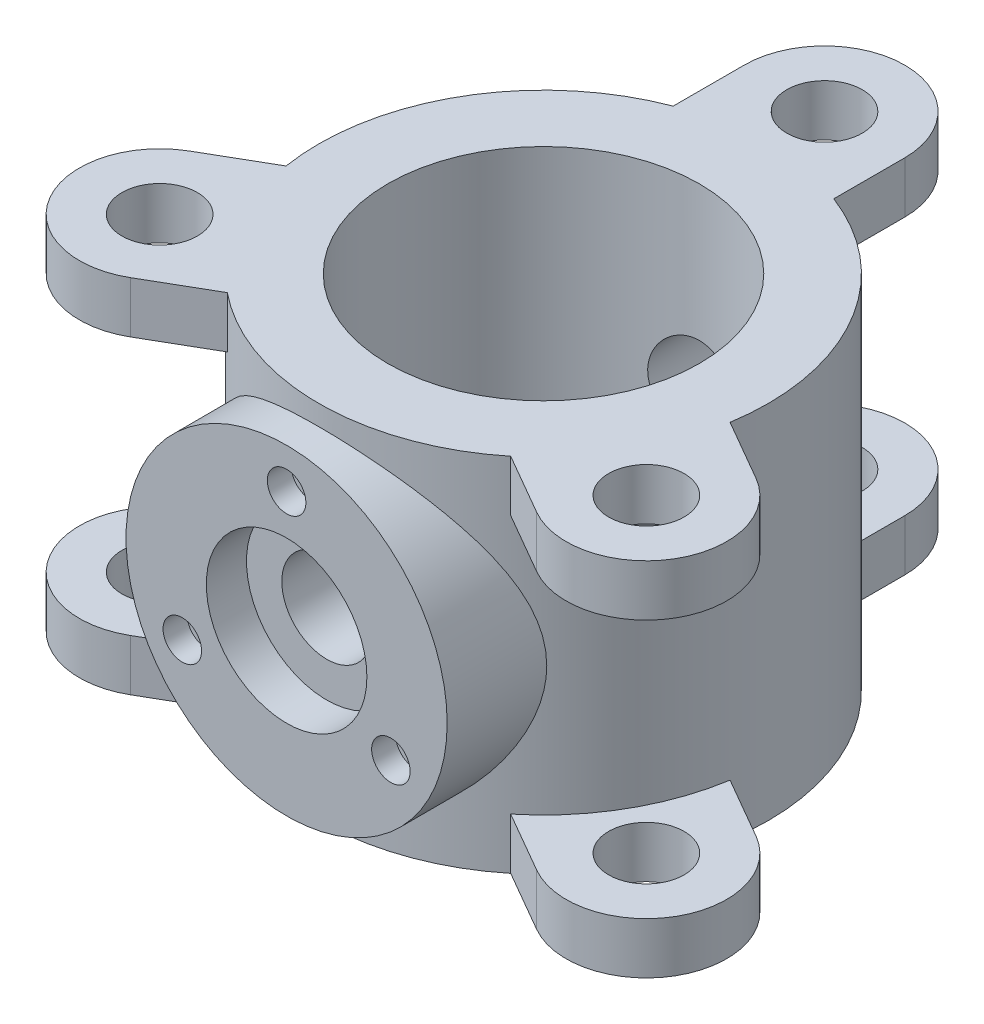
from build123d import *

# Parameters (mm, degrees)
SKETCH1_R                = 140
SKETCH1_R_2              = 97
BOSS_EXTRUDE1_DEPTH      = 225
SKETCH3_R                = 23.5
BOSS_EXTRUDE2_DEPTH      = 32
CIRPATTERN1_COUNT        = 3
MIRROR1_COPY_1_SKETCH_R  = 23.5
MIRROR1_COPY_1_DEPTH     = 32
MIRROR1_COPY_2_SKETCH_R  = 23.5
MIRROR1_COPY_2_DEPTH     = 32
BOSS_EXTRUDE3_REACH      = 491.361
BOSS_EXTRUDE3_END_RADIUS = 140
SKETCH4_R                = 100
SKETCH5_R                = 50
CUT_EXTRUDE1_DEPTH       = 25
SKETCH6_R                = 28
CUT_EXTRUDE2_DEPTH       = 470.945948606
SKETCH7_R                = 12
CUT_EXTRUDE3_DEPTH       = 15
CIRPATTERN2_COUNT        = 3


with BuildPart() as part:
    # Sketch1 → Boss-Extrude1 (new body)
    with BuildSketch(Plane(origin=(0, 0, 0), x_dir=(1, 0, 0), z_dir=(0, 1, 0))):
        with Locations(Location((0, 0, 0), (0, 0, 270))):
            Circle(SKETCH1_R)
        with Locations(Location((0, 0, 0), (0, 0, 270))):
            Circle(SKETCH1_R_2, mode=Mode.SUBTRACT)
    extrude(amount=BOSS_EXTRUDE1_DEPTH)

    # Sketch3 → Boss-Extrude2 (add)
    with BuildSketch(Plane(origin=(0, 225, 0), x_dir=(1, 0, 0), z_dir=(0, 1, 0))):
        with BuildLine():
            Line((50, 175), (50, 101.987166255))
            Line((50, 101.987166255), (-50, 101.987166255))
            Line((-50, 101.987166255), (-50, 175))
            ThreePointArc((-50, 175), (0, 225), (50, 175))
        make_face()
        with Locations(Location((0, 175, 0), (0, 0, 270))):
            Circle(SKETCH3_R, mode=Mode.SUBTRACT)
    boss_extrude2 = extrude(amount=-BOSS_EXTRUDE2_DEPTH)

    # CirPattern1: Boss-Extrude2 ×3 about axis
    cirpattern1_axis = Axis((0, 0, 0), (0, 1, 0))
    for i in range(1, CIRPATTERN1_COUNT):
        add(boss_extrude2.rotate(cirpattern1_axis, i * 360 / CIRPATTERN1_COUNT))

    # Mirror1: Boss-Extrude2 across plane
    add(boss_extrude2.mirror(Plane.ZX.offset(112.5)))

    # Mirror1 copy 1 sketch → Mirror1 copy 1 (add)
    with BuildSketch(Plane(origin=(0, 0, 0), x_dir=(-0.4999999999999998, 0, -0.8660254037844387), z_dir=(0, -1, 0))):
        with BuildLine():
            Line((50, -175), (50, -101.987166255))
            Line((50, -101.987166255), (-50, -101.987166255))
            Line((-50, -101.987166255), (-50, -175))
            ThreePointArc((-50, -175), (0, -225), (50, -175))
        make_face()
        with Locations((0, -175)):
            Circle(MIRROR1_COPY_1_SKETCH_R, mode=Mode.SUBTRACT)
    extrude(amount=-MIRROR1_COPY_1_DEPTH)

    # Mirror1 copy 2 sketch → Mirror1 copy 2 (add)
    with BuildSketch(Plane(origin=(0, 0, 0), x_dir=(-0.5000000000000004, 0, 0.8660254037844384), z_dir=(0, -1, 0))):
        with BuildLine():
            Line((50, -175), (50, -101.987166255))
            Line((50, -101.987166255), (-50, -101.987166255))
            Line((-50, -101.987166255), (-50, -175))
            ThreePointArc((-50, -175), (0, -225), (50, -175))
        make_face()
        with Locations((0, -175)):
            Circle(MIRROR1_COPY_2_SKETCH_R, mode=Mode.SUBTRACT)
    extrude(amount=-MIRROR1_COPY_2_DEPTH)

    # Boss-Extrude3: up to this cylinder (the profile starts outside it)
    boss_extrude3_end = Plane(origin=(0, 112.5, 0), z_dir=(0, -1, 0)) * Cylinder(BOSS_EXTRUDE3_END_RADIUS, 1263.722, mode=Mode.PRIVATE)
    # Sketch4 → Boss-Extrude3 (add, up to the surface)
    with BuildSketch(Plane.XY.offset(160), mode=Mode.PRIVATE) as boss_extrude3_sk1:
        with Locations((0, 112.5)):
            Circle(SKETCH4_R)
    boss_extrude3_tool1 = extrude(boss_extrude3_sk1.sketch, amount=-BOSS_EXTRUDE3_REACH, mode=Mode.PRIVATE) - boss_extrude3_end
    add(boss_extrude3_tool1.solids().sort_by_distance((0, 112.5, 160))[0])

    # Sketch5 → Cut-Extrude1 (cut)
    with BuildSketch(Plane.XY.offset(160)):
        with Locations((0, 112.5)):
            Circle(SKETCH5_R)
    extrude(amount=-CUT_EXTRUDE1_DEPTH, mode=Mode.SUBTRACT)

    # Sketch6 → Cut-Extrude2 (cut, through all)
    with BuildSketch(Plane.XY.offset(135)):
        with Locations((0, 112.5)):
            Circle(SKETCH6_R)
    extrude(amount=-CUT_EXTRUDE2_DEPTH, mode=Mode.SUBTRACT)

    # Sketch7 → Cut-Extrude3 (cut)
    with BuildSketch(Plane.XY.offset(160)):
        with Locations((0, 187.5)):
            Circle(SKETCH7_R)
    cut_extrude3 = extrude(amount=-CUT_EXTRUDE3_DEPTH, mode=Mode.SUBTRACT)

    # CirPattern2: Cut-Extrude3 ×3 about axis
    cirpattern2_axis = Axis((0, 112.5, 0), (0, 0, 1))
    for i in range(1, CIRPATTERN2_COUNT):
        add(cut_extrude3.rotate(cirpattern2_axis, i * 360 / CIRPATTERN2_COUNT), mode=Mode.SUBTRACT)


solid = part.part
